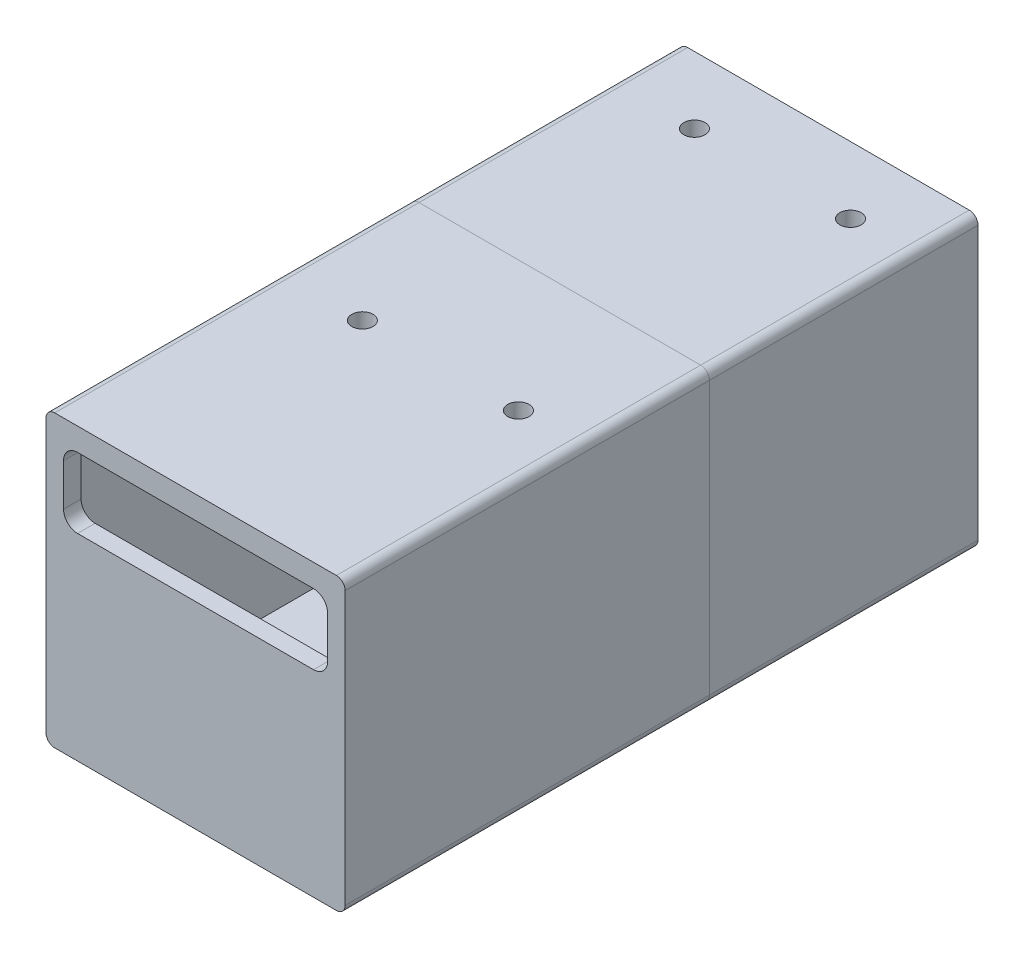
from build123d import *

# Parameters (mm, degrees)
SKETCH1_W            = 85.216
SKETCH1_H            = 81.152
BOSS_EXTRUDE1_DEPTH  = 182.776
SHELL2_T             = -4
SHELL3_T             = -4
SKETCH4_W            = 81.216
SKETCH4_H            = 77.152
SKETCH4_W_2          = 77.216
SKETCH4_H_2          = 73.152
BOSS_EXTRUDE2_DEPTH  = 30
SKETCH5_W            = 81.978
SKETCH5_H            = 77.914
SKETCH5_W_2          = 77.216
SKETCH5_H_2          = 73.152
CUT_EXTRUDE2_DEPTH   = 31
SKETCH6_W            = 75.216
SKETCH6_H            = 20
CUT_EXTRUDE3_DEPTH   = 4
FILLET3_R            = 4
SKETCH7_W            = 85.216
SKETCH7_H            = 81.152
BOSS_EXTRUDE3_DEPTH  = 4
SKETCH8_W            = 85.216
SKETCH8_H            = 81.152
BOSS_EXTRUDE4_DEPTH  = 4
SKETCH10_W           = 77.216
SKETCH10_H           = 73.152
BOSS_EXTRUDE5_DEPTH  = 4.500000096
SKETCH24_W           = 85.216
SKETCH24_H           = 81.152
CUT_EXTRUDE7_DEPTH   = 7.5
SKETCH25_W           = 85.216
SKETCH25_H           = 81.152
CUT_EXTRUDE8_DEPTH   = 3
SKETCH27_W           = 85.216
SKETCH27_H           = 103.776
BOSS_EXTRUDE15_DEPTH = 1.5
SKETCH28_W           = 85.216
SKETCH28_H           = 76.5
BOSS_EXTRUDE16_DEPTH = 1.5
FILLET4_R            = 2.5
FILLET5_R            = 2.5
SKETCH29_R           = 3.025
CUT_EXTRUDE9_DEPTH   = 5


with BuildPart() as part:
    # Sketch1 → Boss-Extrude1 (new body)
    with BuildSketch(Plane.XY):
        Rectangle(SKETCH1_W, SKETCH1_H)
    extrude(amount=BOSS_EXTRUDE1_DEPTH)


with BuildPart() as body_2:
    # Split1: the piece on the far side of the plane
    add(part.part)
    split(bisect_by=Plane(origin=(0, 0, 80), x_dir=(-1, 0, 0), z_dir=(0, 0, -1)), keep=Keep.BOTTOM)

    # Shell3
    shell3_openings = [body_2.faces().sort_by_distance(p)[0] for p in [
        (0, 0, 80),
    ]]
    offset(amount=SHELL3_T, openings=shell3_openings, kind=Kind.INTERSECTION)

    # Sketch5 → Cut-Extrude2 (cut)
    with BuildSketch(Plane(origin=(0, 0, 80), x_dir=(-1, 0, 0), z_dir=(0, 0, -1))):
        Rectangle(SKETCH5_W, SKETCH5_H)
        Rectangle(SKETCH5_W_2, SKETCH5_H_2, mode=Mode.SUBTRACT)
    extrude(amount=-CUT_EXTRUDE2_DEPTH, mode=Mode.SUBTRACT)

    # Sketch6 → Cut-Extrude3 (cut)
    with BuildSketch(Plane.XY.offset(182.776)):
        with Locations((0, 25.576)):
            Rectangle(SKETCH6_W, SKETCH6_H)
    extrude(amount=-CUT_EXTRUDE3_DEPTH, mode=Mode.SUBTRACT)

    # Fillet3
    fillet3_edges = [body_2.edges().sort_by_distance(p)[0] for p in [
        (37.608, 35.576, 180.776),
        (37.608, 15.576, 180.776),
        (-37.608, 15.576, 180.776),
        (-37.608, 35.576, 180.776),
    ]]
    fillet(fillet3_edges, radius=FILLET3_R)

    # Sketch7 → Boss-Extrude3 (add)
    with BuildSketch(Plane.XY.offset(182.776)):
        Rectangle(SKETCH7_W, SKETCH7_H)
        with BuildLine():
            Line((-33.608, 15.576), (33.608, 15.576))
            ThreePointArc((33.608, 15.576), (36.436427125, 16.747572875), (37.608, 19.576))
            Line((37.608, 19.576), (37.608, 31.576))
            ThreePointArc((37.608, 31.576), (36.436427125, 34.404427125), (33.608, 35.576))
            Line((33.608, 35.576), (-33.608, 35.576))
            ThreePointArc((-33.608, 35.576), (-36.436427125, 34.404427125), (-37.608, 31.576))
            Line((-37.608, 31.576), (-37.608, 19.576))
            ThreePointArc((-37.608, 19.576), (-36.436427125, 16.747572875), (-33.608, 15.576))
        make_face(mode=Mode.SUBTRACT)
    extrude(amount=BOSS_EXTRUDE3_DEPTH)

    # Sketch25 → Cut-Extrude8 (cut)
    with BuildSketch(Plane.XY.offset(186.776)):
        Rectangle(SKETCH25_W, SKETCH25_H)
    extrude(amount=-CUT_EXTRUDE8_DEPTH, mode=Mode.SUBTRACT)

    # Sketch27 → Boss-Extrude15 (add)
    with BuildSketch(Plane(origin=(0, 40.576, 0), x_dir=(1, 0, 0), z_dir=(0, 1, 0))):
        with Locations((0, -131.888)):
            Rectangle(SKETCH27_W, SKETCH27_H)
    extrude(amount=BOSS_EXTRUDE15_DEPTH)

    # Fillet4
    fillet4_edges = [body_2.edges().sort_by_distance(p)[0] for p in [
        (42.608, -40.576, 131.888),
        (-42.608, -40.576, 131.888),
        (-42.608, 42.076, 131.888),
        (42.608, 42.076, 131.888),
    ]]
    fillet(fillet4_edges, radius=FILLET4_R)


with BuildPart() as part_1:
    add(part.part)

    # Split1
    split(bisect_by=Plane(origin=(0, 0, 80), x_dir=(-1, 0, 0), z_dir=(0, 0, -1)), keep=Keep.TOP)

    # Shell2
    shell2_openings = [part_1.faces().sort_by_distance(p)[0] for p in [
        (0, 0, 80),
    ]]
    offset(amount=SHELL2_T, openings=shell2_openings, kind=Kind.INTERSECTION)

    # Sketch4 → Boss-Extrude2 (add)
    with BuildSketch(Plane.XY.offset(80)):
        Rectangle(SKETCH4_W, SKETCH4_H)
        Rectangle(SKETCH4_W_2, SKETCH4_H_2, mode=Mode.SUBTRACT)
    extrude(amount=BOSS_EXTRUDE2_DEPTH)

    # Sketch8 → Boss-Extrude4 (add)
    with BuildSketch(Plane(origin=(0, 0, 0), x_dir=(-1, 0, 0), z_dir=(0, 0, -1))):
        Rectangle(SKETCH8_W, SKETCH8_H)
    extrude(amount=BOSS_EXTRUDE4_DEPTH)

    # Sketch10 → Boss-Extrude5 (add)
    with BuildSketch(Plane.XY.offset(4)):
        Rectangle(SKETCH10_W, SKETCH10_H)
    extrude(amount=BOSS_EXTRUDE5_DEPTH)

    # Sketch24 → Cut-Extrude7 (cut)
    with BuildSketch(Plane(origin=(0, 0, -4), x_dir=(-1, 0, 0), z_dir=(0, 0, -1))):
        Rectangle(SKETCH24_W, SKETCH24_H)
    extrude(amount=-CUT_EXTRUDE7_DEPTH, mode=Mode.SUBTRACT)

    # Sketch28 → Boss-Extrude16 (add)
    with BuildSketch(Plane(origin=(0, 40.576, 0), x_dir=(1, 0, 0), z_dir=(0, 1, 0))):
        with Locations((0, -41.75)):
            Rectangle(SKETCH28_W, SKETCH28_H)
    extrude(amount=BOSS_EXTRUDE16_DEPTH)

    # Fillet5
    fillet5_edges = [part_1.edges().sort_by_distance(p)[0] for p in [
        (42.608, 42.076, 41.75),
        (-42.608, 42.076, 41.75),
        (42.608, -40.576, 41.75),
        (-42.608, -40.576, 41.75),
    ]]
    fillet(fillet5_edges, radius=FILLET5_R)


with BuildPart() as cut_extrude9_tool:
    # Sketch29 → Cut-Extrude9 (new body)
    with BuildSketch(Plane(origin=(0, 42.076, 0), x_dir=(1, 0, 0), z_dir=(0, 1, 0))):
        with Locations(Location((25.339474403, -117.147952381, 0), (0, 0, 270))):
            Circle(SKETCH29_R)
        with Locations(Location((-19.110525597, -117.147952381, 0), (0, 0, 270))):
            Circle(SKETCH29_R)
        with Locations(Location((-19.110525597, -22.549952381, 0), (0, 0, 270))):
            Circle(SKETCH29_R)
        with Locations(Location((25.339474403, -22.549952381, 0), (0, 0, 270))):
            Circle(SKETCH29_R)
    extrude(amount=-CUT_EXTRUDE9_DEPTH)


with BuildPart() as part_2:
    add(part_1.part)

    # Cut-Extrude9: cut by cut_extrude9_tool
    add(cut_extrude9_tool.part, mode=Mode.SUBTRACT)


with BuildPart() as body_2_1:
    add(body_2.part)

    # Cut-Extrude9: cut by cut_extrude9_tool
    add(cut_extrude9_tool.part, mode=Mode.SUBTRACT)


solid = Compound([part_2.part, body_2_1.part])
